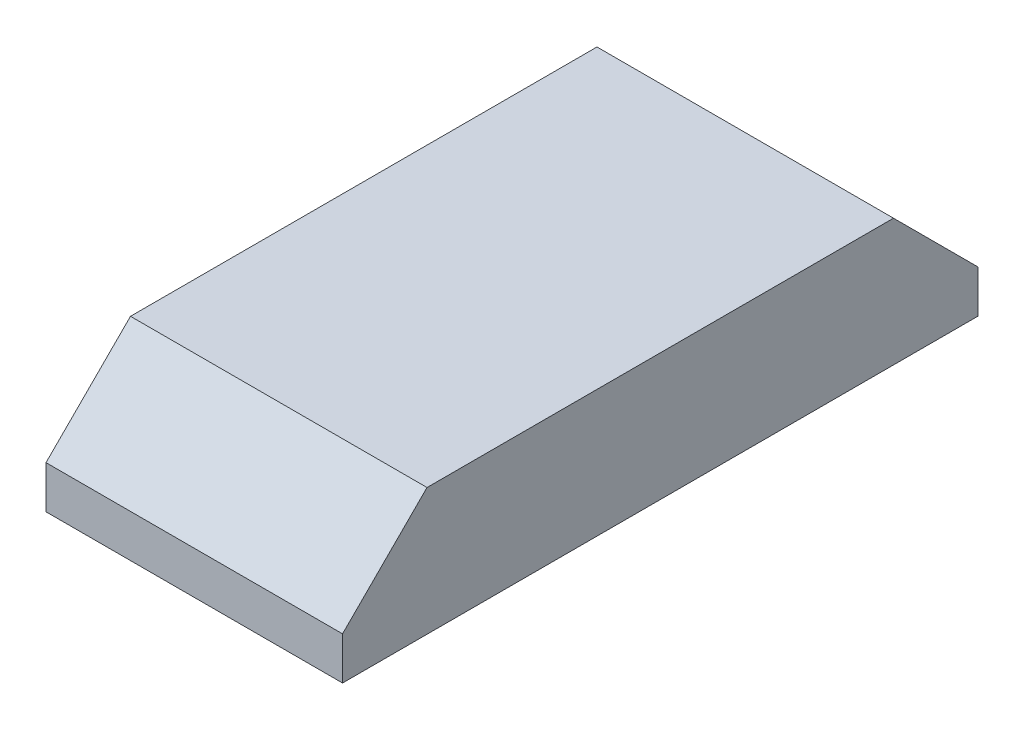
from build123d import *

# Parameters (mm, degrees)
SKETCH1_W           = 88.9
SKETCH1_H           = 190.5
BOSS_EXTRUDE1_DEPTH = 38.1
CUT_EXTRUDE2_DEPTH  = 88.9


with BuildPart() as part:
    # Sketch1 → Boss-Extrude1 (new body)
    with BuildSketch(Plane(origin=(0, 0, 0), x_dir=(1, 0, 0), z_dir=(0, 1, 0))):
        with Locations((44.45, -95.25)):
            Rectangle(SKETCH1_W, SKETCH1_H)
    extrude(amount=BOSS_EXTRUDE1_DEPTH)

    # Sketch2 → Cut-Extrude2 (cut)
    with BuildSketch(Plane(origin=(88.9, 0, 0), x_dir=(0, 0, -1), z_dir=(1, 0, 0))):
        Polygon((-190.5, 12.772845788), (-190.5, 38.1), (-165.172845788, 38.1), align=None)
        Polygon((0, 12.772845788), (-25.327154212, 38.1), (0, 38.1), align=None)
    extrude(amount=-CUT_EXTRUDE2_DEPTH, mode=Mode.SUBTRACT)


solid = part.part
